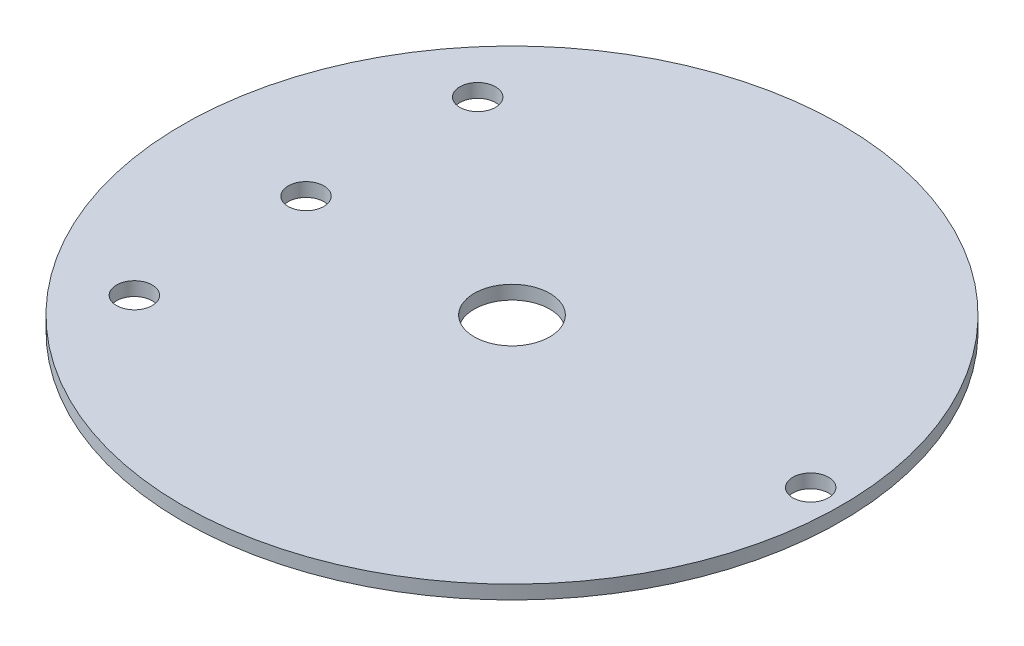
from build123d import *

# Parameters (mm, degrees)
SKETCH1_R           = 48
SKETCH1_R_2         = 2.6
SKETCH1_R_3         = 5.5
BOSS_EXTRUDE1_DEPTH = 2


with BuildPart() as part:
    # Sketch1 → Boss-Extrude1 (new body)
    with BuildSketch(Plane(origin=(0, 0, 0), x_dir=(1, 0, 0), z_dir=(0, 1, 0))):
        with Locations(Location((0, 0, 0), (0, 0, 270))):
            Circle(SKETCH1_R)
        with Locations(Location((-30, 0, 0), (0, 0, 270))):
            Circle(SKETCH1_R_2, mode=Mode.SUBTRACT)
        with Locations(Location((0, 0, 0), (0, 0, 270))):
            Circle(SKETCH1_R_3, mode=Mode.SUBTRACT)
        with Locations(Location((-30, 25, 0), (0, 0, 270))):
            Circle(SKETCH1_R_2, mode=Mode.SUBTRACT)
        with Locations(Location((-30, -25, 0), (0, 0, 270))):
            Circle(SKETCH1_R_2, mode=Mode.SUBTRACT)
        with Locations(Location((43.5, 0, 0), (0, 0, 270))):
            Circle(SKETCH1_R_2, mode=Mode.SUBTRACT)
    extrude(amount=BOSS_EXTRUDE1_DEPTH)


solid = part.part
